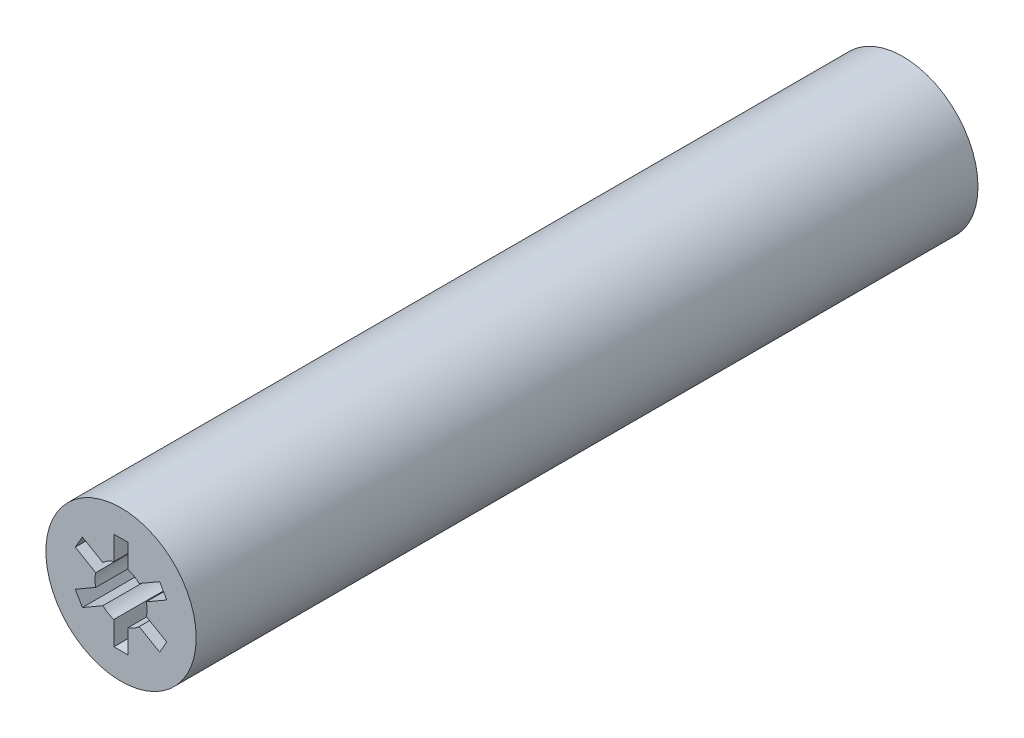
from build123d import *

# Parameters (mm, degrees)
SKETCH1_R           = 15.875
BOSS_EXTRUDE1_DEPTH = 82.55


with BuildPart() as part:
    # Sketch1 → Boss-Extrude1 (new, symmetric)
    with BuildSketch(Plane.XY):
        Circle(SKETCH1_R)
        with BuildLine():
            Line((-1.5, 5.291502622), (-1.5, 10.291502622))
            Line((-1.5, 10.291502622), (1.5, 10.291502622))
            Line((1.5, 10.291502622), (1.5, 5.291502622))
            ThreePointArc((1.5, 5.291502622), (2.75, 4.763139721), (3.832575695, 3.944789417))
            Line((3.832575695, 3.944789417), (8.162702714, 6.444789417))
            Line((8.162702714, 6.444789417), (9.662702714, 3.846713205))
            Line((9.662702714, 3.846713205), (5.332575695, 1.346713205))
            ThreePointArc((5.332575695, 1.346713205), (5.5, 0), (5.332575695, -1.346713205))
            Line((5.332575695, -1.346713205), (9.662702714, -3.846713205))
            Line((9.662702714, -3.846713205), (8.162702714, -6.444789417))
            Line((8.162702714, -6.444789417), (3.832575695, -3.944789417))
            ThreePointArc((3.832575695, -3.944789417), (2.75, -4.763139721), (1.5, -5.291502622))
            Line((1.5, -5.291502622), (1.5, -10.291502622))
            Line((1.5, -10.291502622), (-1.5, -10.291502622))
            Line((-1.5, -10.291502622), (-1.5, -5.291502622))
            ThreePointArc((-1.5, -5.291502622), (-2.75, -4.763139721), (-3.832575695, -3.944789417))
            Line((-3.832575695, -3.944789417), (-8.162702714, -6.444789417))
            Line((-8.162702714, -6.444789417), (-9.662702714, -3.846713205))
            Line((-9.662702714, -3.846713205), (-5.332575695, -1.346713205))
            ThreePointArc((-5.332575695, -1.346713205), (-5.5, 0), (-5.332575695, 1.346713205))
            Line((-5.332575695, 1.346713205), (-9.662702714, 3.846713205))
            Line((-9.662702714, 3.846713205), (-8.162702714, 6.444789417))
            Line((-8.162702714, 6.444789417), (-3.832575695, 3.944789417))
            ThreePointArc((-3.832575695, 3.944789417), (-2.75, 4.763139721), (-1.5, 5.291502622))
        make_face(mode=Mode.SUBTRACT)
    extrude(amount=BOSS_EXTRUDE1_DEPTH, both=True)


solid = part.part
